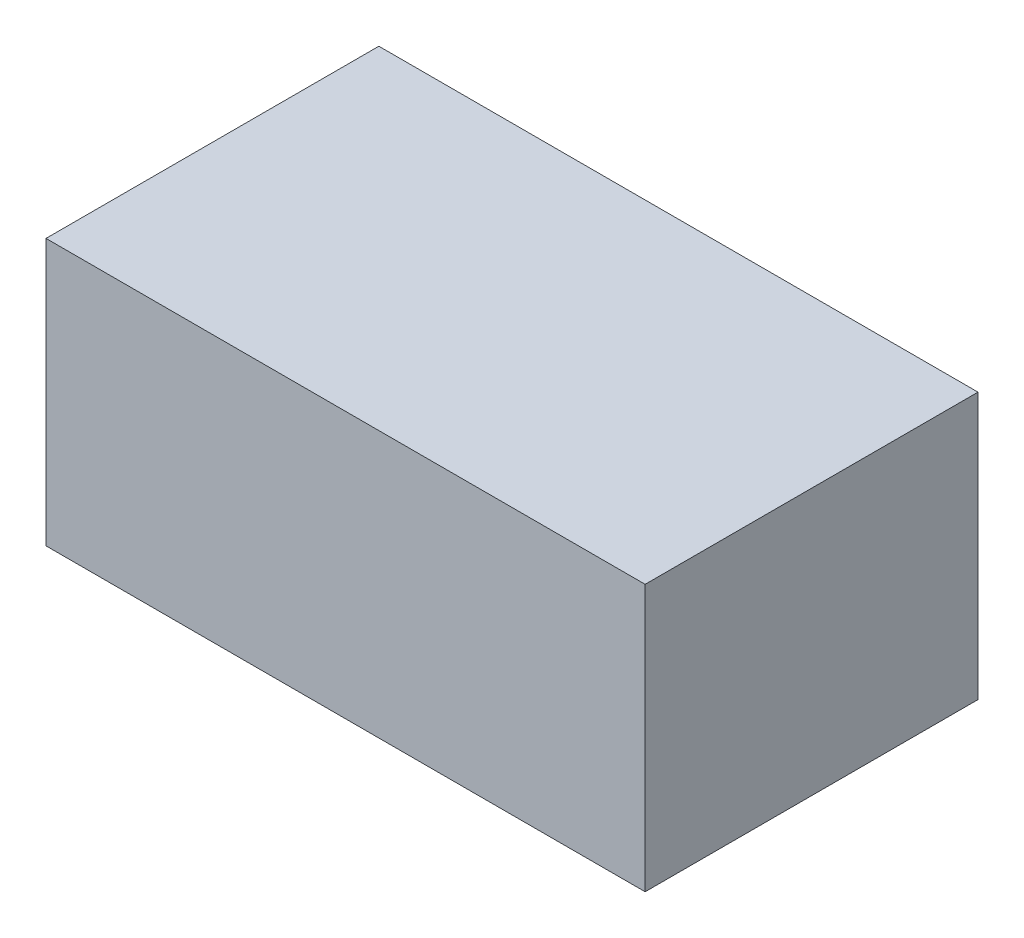
from build123d import *

# Parameters (mm, degrees)
SKETCH1_W           = 72
SKETCH1_H           = 32
BOSS_EXTRUDE1_DEPTH = 40


with BuildPart() as part:
    # Sketch1 → Boss-Extrude1 (new body)
    with BuildSketch(Plane.XY):
        Rectangle(SKETCH1_W, SKETCH1_H)
    extrude(amount=-BOSS_EXTRUDE1_DEPTH)


solid = part.part
